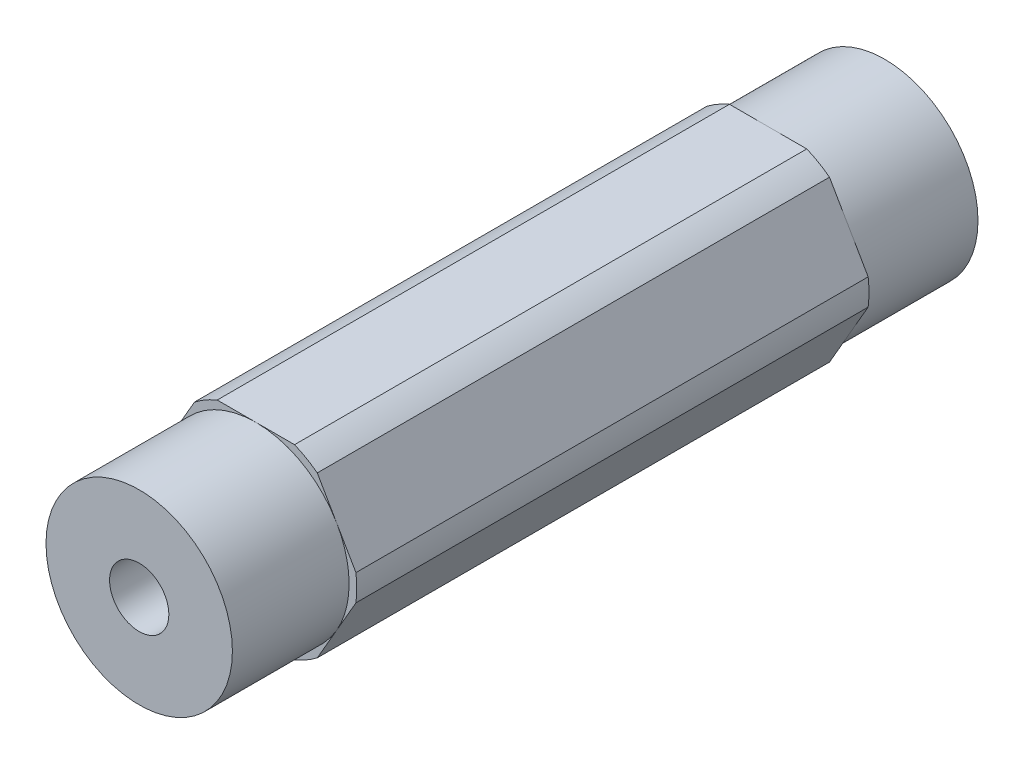
from build123d import *

# Parameters (mm, degrees)
BOSS_EXTRUDE1_DEPTH = 25.4
SKETCH2_OUTSIDE_W   = 27.54
SKETCH2_OUTSIDE_H   = 25.576
SKETCH2_OUTSIDE_R   = 6.35
CUT_EXTRUDE2_DEPTH  = 7.9502
SKETCH3_OUTSIDE_W   = 27.54
SKETCH3_OUTSIDE_H   = 25.576
SKETCH3_OUTSIDE_R   = 6.875
CUT_EXTRUDE4_DEPTH  = 52.717751627
SKETCH4_R           = 2.0193
CUT_EXTRUDE5_DEPTH  = 52.654894492


with BuildPart() as part:
    # Sketch1 → Boss-Extrude1 (new, symmetric)
    with BuildSketch(Plane.XY):
        Polygon((7.332348419, 0), (3.666174209, 6.35), (-3.666174209, 6.35), (-7.332348419, 0), (-3.666174209, -6.35), (3.666174209, -6.35), align=None)
    extrude(amount=BOSS_EXTRUDE1_DEPTH, both=True)

    # Sketch2 outside → Cut-Extrude2 (cut)
    with BuildSketch(Plane.XY.offset(25.4)):
        Rectangle(SKETCH2_OUTSIDE_W, SKETCH2_OUTSIDE_H)
        Circle(SKETCH2_OUTSIDE_R, mode=Mode.SUBTRACT)
    cut_extrude2 = extrude(amount=-CUT_EXTRUDE2_DEPTH, mode=Mode.SUBTRACT)

    # Sketch3 outside → Cut-Extrude4 (cut, through all)
    with BuildSketch(Plane.XY.offset(25.4)):
        Rectangle(SKETCH3_OUTSIDE_W, SKETCH3_OUTSIDE_H)
        Circle(SKETCH3_OUTSIDE_R, mode=Mode.SUBTRACT)
    extrude(amount=-CUT_EXTRUDE4_DEPTH, mode=Mode.SUBTRACT)

    # Mirror1: Cut-Extrude2 across plane
    add(cut_extrude2.mirror(Plane.XY), mode=Mode.SUBTRACT)

    # Sketch4 → Cut-Extrude5 (cut, through all)
    with BuildSketch(Plane.XY.offset(25.4)):
        Circle(SKETCH4_R)
    extrude(amount=-CUT_EXTRUDE5_DEPTH, mode=Mode.SUBTRACT)


solid = part.part
